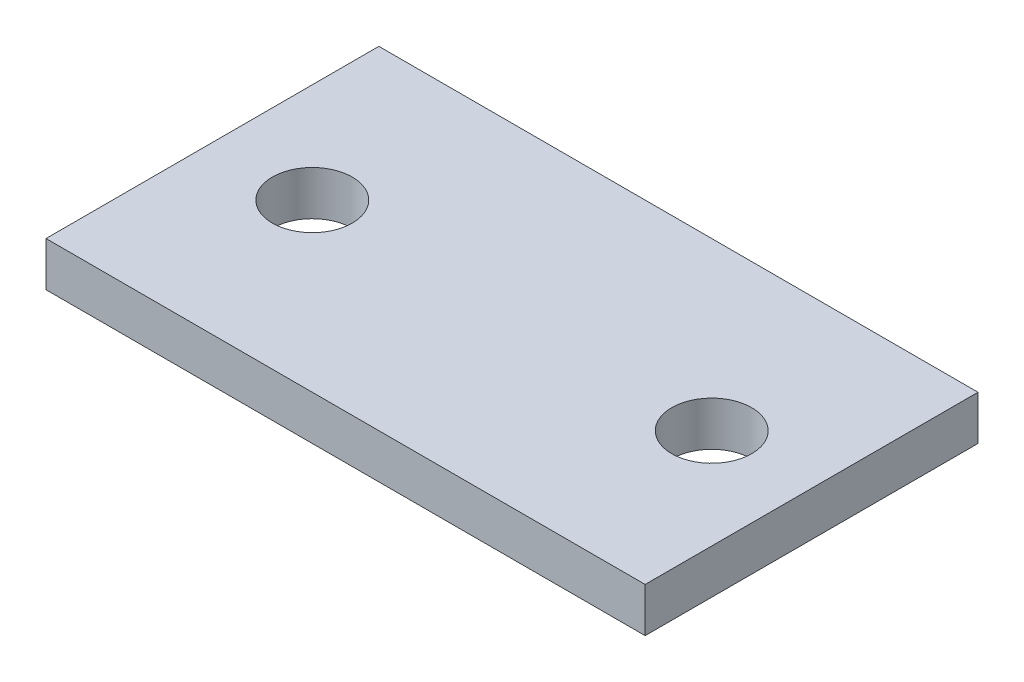
from build123d import *

# Parameters (mm, degrees)
ESQUISSE1_W        = 13.5
ESQUISSE1_H        = 7.5
ESQUISSE1_R        = 0.9
BOSS_EXTRU_1_DEPTH = 1


with BuildPart() as part:
    # Esquisse1 → Boss.-Extru.1 (new body)
    with BuildSketch(Plane(origin=(0, 0, 0), x_dir=(1, 0, 0), z_dir=(0, 1, 0))):
        Rectangle(ESQUISSE1_W, ESQUISSE1_H)
        with Locations(Location((-4.5, 0, 0), (0, 0, 270))):
            Circle(ESQUISSE1_R, mode=Mode.SUBTRACT)
        with Locations(Location((4.5, 0, 0), (0, 0, 270))):
            Circle(ESQUISSE1_R, mode=Mode.SUBTRACT)
    extrude(amount=BOSS_EXTRU_1_DEPTH)


solid = part.part
